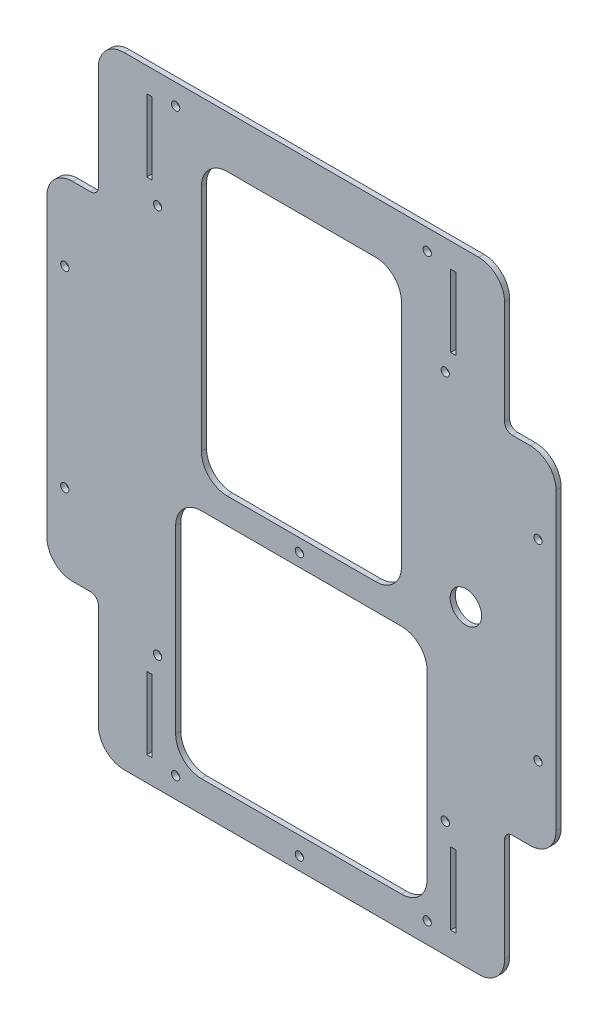
from build123d import *

# Parameters (mm, degrees)
Y_KSEKLIK_EKSTR_ZYON1_DEPTH = 2
RADYUS1_R                   = 10
RADYUS2_R                   = 3
IZIM2_W                     = 2.1
IZIM2_H                     = 28
KES_EKSTR_ZYON1_DEPTH       = 10
KES_EKSTR_ZYON2_DEPTH       = 10
KES_EKSTR_ZYON3_DEPTH       = 10
IZIM5_R                     = 6.1
KES_EKSTR_ZYON4_DEPTH       = 10
IZIM6_R                     = 1.6
KES_EKSTR_ZYON5_DEPTH       = 10


with BuildPart() as part:
    # Çizim1 → Yükseklik-Ekstrüzyon1 (new body)
    with BuildSketch(Plane.XY):
        Polygon((78.397764574, 53), (78.397764574, 58), (-79.202235426, 58), (-79.202235426, 53), (-79.202235426, 4.7), (-99.202235426, 4.7), (-99.202235426, -129.7), (-79.202235426, -129.7), (-79.202235426, -178), (-79.202235426, -183), (78.397764574, -183), (78.397764574, -178), (78.397764574, -129.7), (98.397764574, -129.7), (98.397764574, 4.7), (78.397764574, 4.7), align=None)
    extrude(amount=Y_KSEKLIK_EKSTR_ZYON1_DEPTH)

    # Radyus1
    radyus1_edges = [part.edges().sort_by_distance(p)[0] for p in [
        (-79.202235426, 58, 1),
        (78.397764574, 58, 1),
        (98.397764574, 4.7, 1),
        (98.397764574, -129.7, 1),
        (78.397764574, -183, 1),
        (-79.202235426, -183, 1),
        (-99.202235426, -129.7, 1),
        (-99.202235426, 4.7, 1),
    ]]
    fillet(radyus1_edges, radius=RADYUS1_R)

    # Radyus2
    radyus2_edges = [part.edges().sort_by_distance(p)[0] for p in [
        (78.397764574, 4.7, 1),
        (78.397764574, -129.7, 1),
        (-79.202235426, -129.7, 1),
        (-79.202235426, 4.7, 1),
    ]]
    fillet(radyus2_edges, radius=RADYUS2_R)

    # Çizim2 → Kes-Ekstrüzyon1 (cut)
    with BuildSketch(Plane(origin=(0, 0, 0), x_dir=(-1, 0, 0), z_dir=(0, 0, -1))):
        with Locations((-58.547764574, -159.55)):
            Rectangle(IZIM2_W, IZIM2_H)
        with Locations((59.352235426, -159.55)):
            Rectangle(IZIM2_W, IZIM2_H)
        with Locations((59.352235426, 34.55)):
            Rectangle(IZIM2_W, IZIM2_H)
        with Locations((-58.547764574, 34.55)):
            Rectangle(IZIM2_W, IZIM2_H)
    extrude(amount=-KES_EKSTR_ZYON1_DEPTH, mode=Mode.SUBTRACT)

    # Çizim3 → Kes-Ekstrüzyon2 (cut)
    with BuildSketch(Plane(origin=(0, 0, 0), x_dir=(-1, 0, 0), z_dir=(0, 0, -1))):
        with BuildLine():
            Line((39.202235426, -171), (-38.397764574, -171))
            ThreePointArc((-38.397764574, -171), (-45.468832385, -168.071067812), (-48.397764574, -161))
            Line((-48.397764574, -161), (-48.397764574, -91))
            ThreePointArc((-48.397764574, -91), (-45.468832385, -83.928932188), (-38.397764574, -81))
            Line((-38.397764574, -81), (39.202235426, -81))
            ThreePointArc((39.202235426, -81), (46.273303238, -83.928932188), (49.202235426, -91))
            Line((49.202235426, -91), (49.202235426, -161))
            ThreePointArc((49.202235426, -161), (46.273303238, -168.071067812), (39.202235426, -171))
        make_face()
    extrude(amount=-KES_EKSTR_ZYON2_DEPTH, mode=Mode.SUBTRACT)

    # Çizim4 → Kes-Ekstrüzyon3 (cut)
    with BuildSketch(Plane(origin=(0, 0, 0), x_dir=(-1, 0, 0), z_dir=(0, 0, -1))):
        with BuildLine():
            Line((29.202235426, -71), (-28.397764574, -71))
            ThreePointArc((-28.397764574, -71), (-35.468832385, -68.071067812), (-38.397764574, -61))
            Line((-38.397764574, -61), (-38.397764574, 28))
            ThreePointArc((-38.397764574, 28), (-35.468832385, 35.071067812), (-28.397764574, 38))
            Line((-28.397764574, 38), (29.202235426, 38))
            ThreePointArc((29.202235426, 38), (36.273303238, 35.071067812), (39.202235426, 28))
            Line((39.202235426, 28), (39.202235426, -61))
            ThreePointArc((39.202235426, -61), (36.273303238, -68.071067812), (29.202235426, -71))
        make_face()
    extrude(amount=-KES_EKSTR_ZYON3_DEPTH, mode=Mode.SUBTRACT)

    # Çizim5 → Kes-Ekstrüzyon4 (cut)
    with BuildSketch(Plane(origin=(0, 0, 0), x_dir=(-1, 0, 0), z_dir=(0, 0, -1))):
        with Locations((-63.397764574, -62)):
            Circle(IZIM5_R)
    extrude(amount=-KES_EKSTR_ZYON4_DEPTH, mode=Mode.SUBTRACT)

    # Çizim6 → Kes-Ekstrüzyon5 (cut)
    with BuildSketch(Plane(origin=(0, 0, 0), x_dir=(-1, 0, 0), z_dir=(0, 0, -1))):
        with Locations((49.202235426, -175)):
            Circle(IZIM6_R)
        with Locations((56.202235426, -138)):
            Circle(IZIM6_R)
        with Locations((1.202235426, -76)):
            Circle(IZIM6_R)
        with Locations((1.202235426, -178)):
            Circle(IZIM6_R)
        with Locations((92.202235426, -99.7)):
            Circle(IZIM6_R)
        with Locations((92.202235426, -25.3)):
            Circle(IZIM6_R)
        with Locations((56.202235426, 13)):
            Circle(IZIM6_R)
        with Locations((49.202235426, 50)):
            Circle(IZIM6_R)
        with Locations((-48.397764574, 50)):
            Circle(IZIM6_R)
        with Locations((-55.397764574, 13)):
            Circle(IZIM6_R)
        with Locations((-91.397764574, -25.3)):
            Circle(IZIM6_R)
        with Locations((-91.397764574, -99.7)):
            Circle(IZIM6_R)
        with Locations((-55.397764574, -138)):
            Circle(IZIM6_R)
        with Locations((-48.397764574, -175)):
            Circle(IZIM6_R)
    extrude(amount=-KES_EKSTR_ZYON5_DEPTH, mode=Mode.SUBTRACT)


solid = part.part
